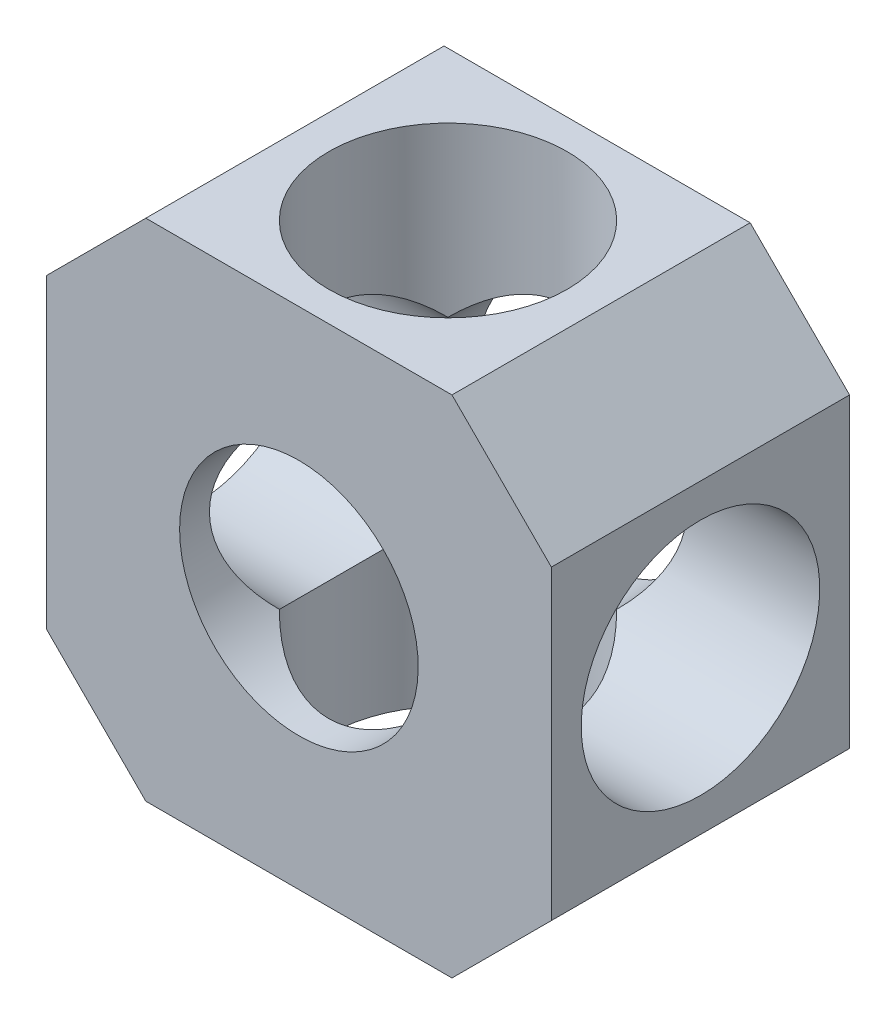
from build123d import *

# Parameters (mm, degrees)
SKETCH1_W               = 25.4
SKETCH1_H               = 25.4
BOSS_EXTRUDE1_DEPTH     = 7.5
CHAMFER1_SIZE           = 5
CUT_EXTRUDE1_DEPTH      = 24.400427347
CUT_EXTRUDE1_DEPTH_BACK = 24.400427347
SKETCH2_R               = 6
SKETCH3_R               = 6
CUT_EXTRUDE2_DEPTH      = 30.37175514
CIRPATTERN1_COUNT       = 4


with BuildPart() as part:
    # Sketch1 → Boss-Extrude1 (new, symmetric)
    with BuildSketch(Plane.XY):
        Rectangle(SKETCH1_W, SKETCH1_H)
    extrude(amount=BOSS_EXTRUDE1_DEPTH, both=True)

    # Chamfer1
    chamfer1_edges = [part.edges().sort_by_distance(p)[0] for p in [
        (-12.7, 12.7, 0),
        (12.7, 12.7, 0),
        (12.7, -12.7, 0),
        (-12.7, -12.7, 0),
    ]]
    chamfer(chamfer1_edges, length=CHAMFER1_SIZE)

    # Sketch2 → Cut-Extrude1 (cut, two sides: drawn at the far end of the back side and taken through both)
    with BuildSketch(Plane.XY.offset(7.5).offset(-CUT_EXTRUDE1_DEPTH_BACK)):
        Circle(SKETCH2_R)
    extrude(amount=CUT_EXTRUDE1_DEPTH + CUT_EXTRUDE1_DEPTH_BACK, mode=Mode.SUBTRACT)

    # Sketch3 → Cut-Extrude2 (cut, symmetric)
    with BuildSketch(Plane.ZY.offset(12.7)):
        with Locations(Location((0, 0, 0), (0, 0, 90))):
            Circle(SKETCH3_R)
    cut_extrude2 = extrude(amount=CUT_EXTRUDE2_DEPTH, both=True, mode=Mode.SUBTRACT)

    # CirPattern1: Cut-Extrude2 ×4 about axis
    cirpattern1_axis = Axis((0, 0, -7.5), (0, 0, 1))
    for i in range(1, CIRPATTERN1_COUNT):
        add(cut_extrude2.rotate(cirpattern1_axis, i * 360 / CIRPATTERN1_COUNT), mode=Mode.SUBTRACT)


solid = part.part
